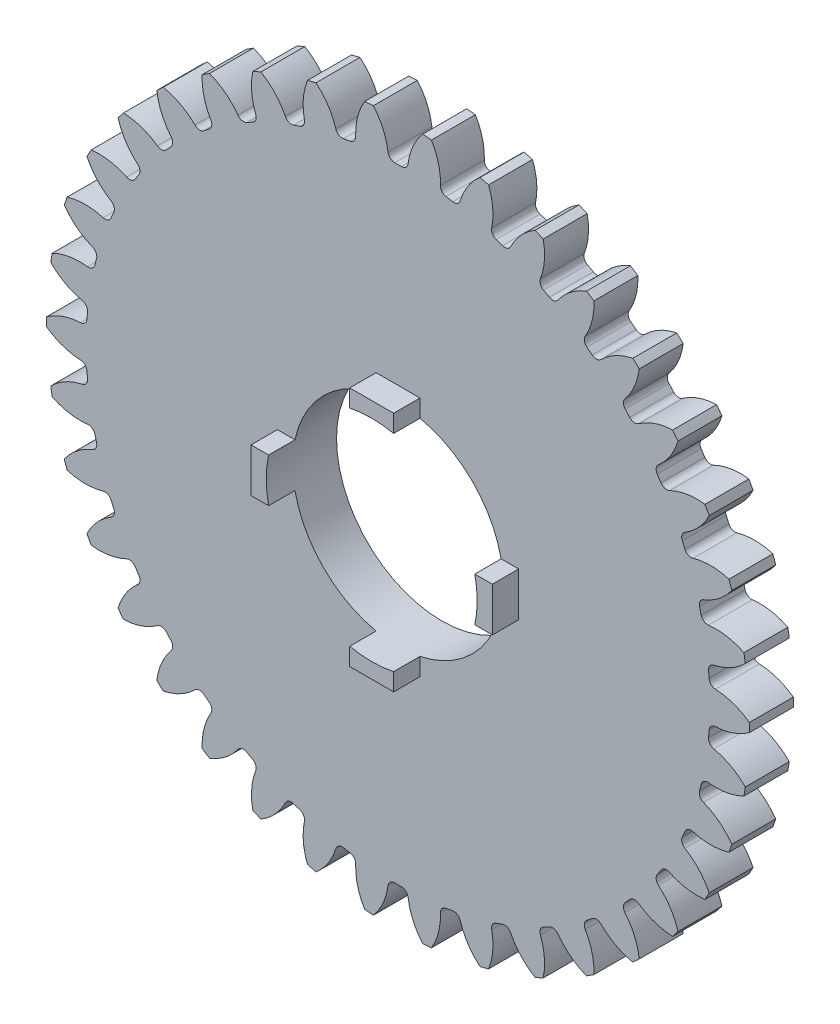
from build123d import *

# Parameters (mm, degrees)
SKETCH1_R                = 40
BOSS_EXTRUDE1_DEPTH      = 5
CUT_EXTRUDE1_DEPTH       = 10
FILLET2_R                = 0.76
CIRPATTERN2_COUNT        = 38
FILLET2_OF_CIRPATTERN2_R = 0.76
SKETCH2_R                = 12
CUT_EXTRUDE2_DEPTH       = 5
BOSS_EXTRUDE2_START      = 3
BOSS_EXTRUDE2_DEPTH      = 3


with BuildPart() as part:
    # Sketch1 → Boss-Extrude1 (new body)
    with BuildSketch(Plane.XY):
        Circle(SKETCH1_R)
    extrude(amount=-BOSS_EXTRUDE1_DEPTH)

    # Sketch1<4> → Cut-Extrude1 (cut)
    with BuildSketch(Plane.XY):
        with BuildLine():
            ThreePointArc((-1.092205387, 35.483194436), (0, 35.5), (1.092205387, 35.483194436))
            ThreePointArc((1.092205387, 35.483194436), (1.57036425, 37.838897504), (2.804633244, 39.90155426))
            ThreePointArc((2.804633244, 39.90155426), (0, 40), (-2.804633244, 39.90155426))
            ThreePointArc((-2.804633244, 39.90155426), (-1.57036425, 37.838897504), (-1.092205387, 35.483194436))
        make_face()
    cut_extrude1 = extrude(amount=-CUT_EXTRUDE1_DEPTH, mode=Mode.SUBTRACT)

    # Fillet2
    fillet2_edges = [part.edges().sort_by_distance(p)[0] for p in [
        (1.092205387, 35.483194436, -2.5),
        (-1.092205387, 35.483194436, -2.5),
    ]]
    fillet(fillet2_edges, radius=FILLET2_R)

    # CirPattern2: Cut-Extrude1 ×38 about axis
    cirpattern2_axis = Axis((0, 0, 0), (0, 0, 1))
    for i in range(1, CIRPATTERN2_COUNT):
        add(cut_extrude1.rotate(cirpattern2_axis, i * 360 / CIRPATTERN2_COUNT), mode=Mode.SUBTRACT)

    # Fillet2 of CirPattern2
    fillet2_of_cirpattern2_edges = [part.edges().sort_by_distance(p)[0] for p in [
        (-4.763032721, 35.179021011, -2.5),
        (-6.917650979, 34.819478815, -2.5),
        (-10.488347713, 33.915255598, -2.5),
        (-12.554401085, 33.205978579, -2.5),
        (-15.92756792, 31.726370422, -2.5),
        (-17.848699857, 30.686705809, -2.5),
        (-20.932325594, 28.672072566, -2.5),
        (-22.656132625, 27.330379699, -2.5),
        (-25.366103993, 24.835675312, -2.5),
        (-26.845565154, 23.228552076, -2.5),
        (-29.107961199, 20.321825578, -2.5),
        (-30.302720648, 18.493110104, -2.5),
        (-32.055829103, 15.253649417, -2.5),
        (-32.933296916, 13.253224297, -2.5),
        (-34.129297551, 9.769393464, -2.5),
        (-34.665538694, 7.651825079, -2.5),
        (-35.271807731, 4.018653923, -2.5),
        (-35.452194943, 1.84170402, -2.5),
        (-35.452194943, -1.84170402, -2.5),
        (-35.271807731, -4.018653923, -2.5),
        (-34.665538694, -7.651825079, -2.5),
        (-34.129297551, -9.769393464, -2.5),
        (-32.933296916, -13.253224297, -2.5),
        (-32.055829103, -15.253649417, -2.5),
        (-30.302720648, -18.493110104, -2.5),
        (-29.107961199, -20.321825578, -2.5),
        (-26.845565154, -23.228552076, -2.5),
        (-25.366103993, -24.835675312, -2.5),
        (-22.656132625, -27.330379699, -2.5),
        (-20.932325594, -28.672072566, -2.5),
        (-17.848699857, -30.686705809, -2.5),
        (-15.92756792, -31.726370422, -2.5),
        (-12.554401085, -33.205978579, -2.5),
        (-10.488347713, -33.915255598, -2.5),
        (-6.917650979, -34.819478815, -2.5),
        (-4.763032721, -35.179021011, -2.5),
        (-1.092205387, -35.483194436, -2.5),
        (1.092205387, -35.483194436, -2.5),
        (4.763032721, -35.179021011, -2.5),
        (6.917650979, -34.819478815, -2.5),
        (10.488347713, -33.915255598, -2.5),
        (12.554401085, -33.205978579, -2.5),
        (15.92756792, -31.726370422, -2.5),
        (17.848699857, -30.686705809, -2.5),
        (20.932325594, -28.672072566, -2.5),
        (22.656132625, -27.330379699, -2.5),
        (25.366103993, -24.835675312, -2.5),
        (26.845565154, -23.228552076, -2.5),
        (29.107961199, -20.321825578, -2.5),
        (30.302720648, -18.493110104, -2.5),
        (32.055829103, -15.253649417, -2.5),
        (32.933296916, -13.253224297, -2.5),
        (34.129297551, -9.769393464, -2.5),
        (34.665538694, -7.651825079, -2.5),
        (35.271807731, -4.018653923, -2.5),
        (35.452194943, -1.84170402, -2.5),
        (35.452194943, 1.84170402, -2.5),
        (35.271807731, 4.018653923, -2.5),
        (34.665538694, 7.651825079, -2.5),
        (34.129297551, 9.769393464, -2.5),
        (32.933296916, 13.253224297, -2.5),
        (32.055829103, 15.253649417, -2.5),
        (30.302720648, 18.493110104, -2.5),
        (29.107961199, 20.321825578, -2.5),
        (26.845565154, 23.228552076, -2.5),
        (25.366103993, 24.835675312, -2.5),
        (22.656132625, 27.330379699, -2.5),
        (20.932325594, 28.672072566, -2.5),
        (17.848699857, 30.686705809, -2.5),
        (15.92756792, 31.726370422, -2.5),
        (12.554401085, 33.205978579, -2.5),
        (10.488347713, 33.915255598, -2.5),
        (6.917650979, 34.819478815, -2.5),
        (4.763032721, 35.179021011, -2.5),
    ]]
    fillet(fillet2_of_cirpattern2_edges, radius=FILLET2_OF_CIRPATTERN2_R)

    # Sketch2 → Cut-Extrude2 (cut)
    with BuildSketch(Plane.XY):
        Circle(SKETCH2_R)
    extrude(amount=-CUT_EXTRUDE2_DEPTH, mode=Mode.SUBTRACT)

    # Sketch3 → Boss-Extrude2 (add)
    with BuildSketch(Plane.XY.offset(BOSS_EXTRUDE2_START)):
        with BuildLine():
            Line((-2.5, 11.736694594), (-2.5, 13.736694594))
            Line((-2.5, 13.736694594), (2.5, 13.736694594))
            Line((2.5, 13.736694594), (2.5, 11.736694594))
            ThreePointArc((2.5, 11.736694594), (0, 12), (-2.5, 11.736694594))
        make_face()
        with BuildLine():
            Line((13.736694594, -2.5), (11.736694594, -2.5))
            ThreePointArc((11.736694594, -2.5), (12, 0), (11.736694594, 2.5))
            Line((11.736694594, 2.5), (13.736694594, 2.5))
            Line((13.736694594, 2.5), (13.736694594, -2.5))
        make_face()
        with BuildLine():
            Line((-2.5, -13.736694594), (-2.5, -11.736694594))
            ThreePointArc((-2.5, -11.736694594), (0, -12), (2.5, -11.736694594))
            Line((2.5, -11.736694594), (2.5, -13.736694594))
            Line((2.5, -13.736694594), (-2.5, -13.736694594))
        make_face()
        with BuildLine():
            Line((-13.736694594, 2.5), (-11.736694594, 2.5))
            ThreePointArc((-11.736694594, 2.5), (-12, 0), (-11.736694594, -2.5))
            Line((-11.736694594, -2.5), (-13.736694594, -2.5))
            Line((-13.736694594, -2.5), (-13.736694594, 2.5))
        make_face()
    extrude(amount=-BOSS_EXTRUDE2_DEPTH)


solid = part.part
